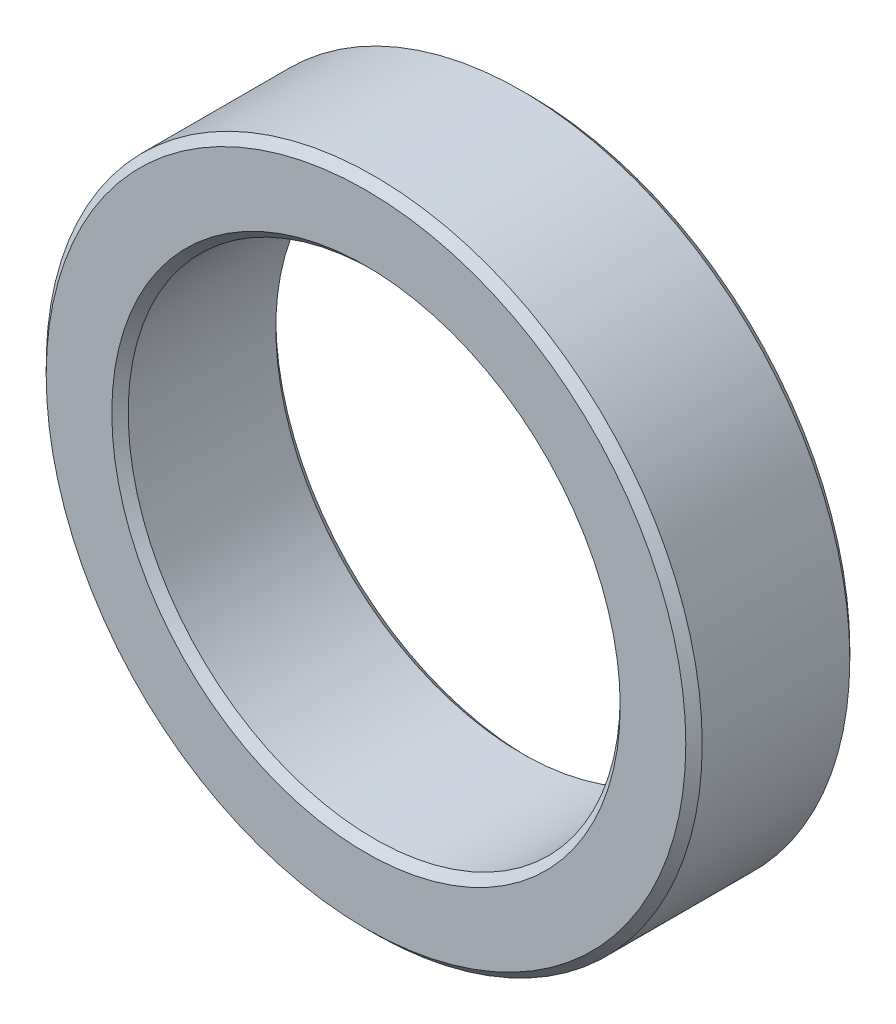
from build123d import *

# Parameters (mm, degrees)
ESQUISSE1_R        = 8
ESQUISSE1_R_2      = 6
BOSS_EXTRU_1_DEPTH = 4
CHANFREIN1_SIZE    = 0.2


with BuildPart() as part:
    # Esquisse1 → Boss.-Extru.1 (new body)
    with BuildSketch(Plane.XY):
        Circle(ESQUISSE1_R)
        Circle(ESQUISSE1_R_2, mode=Mode.SUBTRACT)
    extrude(amount=BOSS_EXTRU_1_DEPTH)

    # Chanfrein1
    chanfrein1_edges = [part.edges().sort_by_distance(p)[0] for p in [
        (-8, 0, 0),
        (-8, 0, 4),
        (-6, 0, 0),
        (-6, 0, 4),
    ]]
    chamfer(chanfrein1_edges, length=CHANFREIN1_SIZE)


solid = part.part
